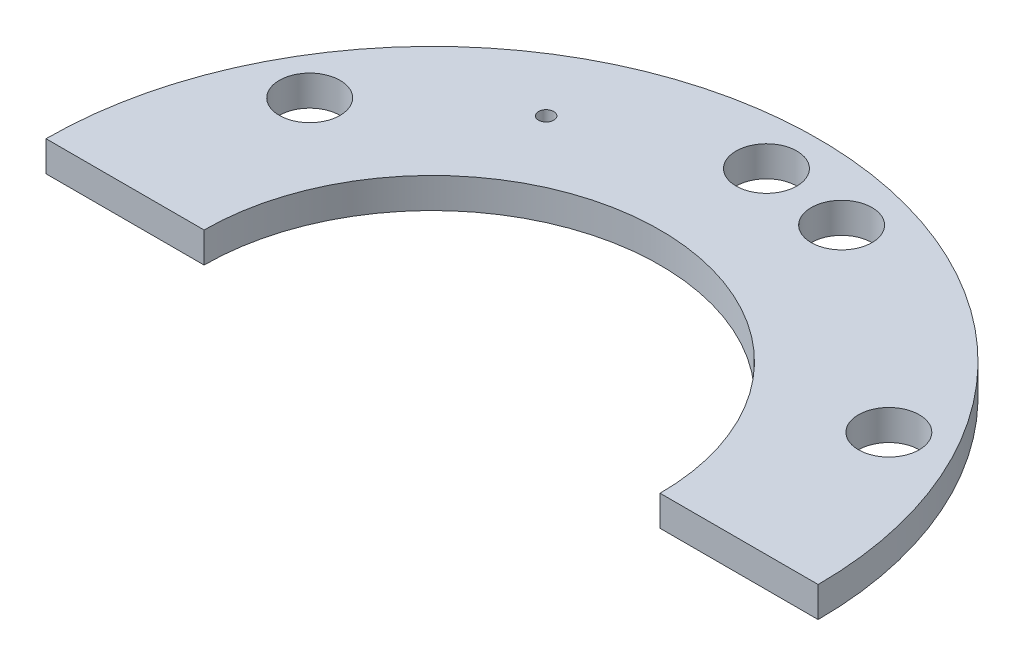
from build123d import *

# Parameters (mm, degrees)
SKETCH1_R               = 12.7
BOSS_EXTRUDE1_DEPTH     = 1
CUT_EXTRUDE1_DEPTH      = 18.98832955
CUT_EXTRUDE1_DEPTH_BACK = 18.98832955
SKETCH19_R              = 1
CUT_EXTRUDE2_DEPTH      = 18.98832955
CUT_EXTRUDE2_DEPTH_BACK = 18.98832955
SKETCH20_R              = 7.5
SKETCH21_W              = 65.874202484
SKETCH21_H              = 51.979273979
CUT_EXTRUDE3_DEPTH      = 18.98832955
CUT_EXTRUDE4_DEPTH      = 18.98832955
CUT_EXTRUDE4_DEPTH_BACK = 18.98832955
SKETCH22_R              = 0.25
CUT_EXTRUDE5_DEPTH      = 18.98832955
CUT_EXTRUDE5_DEPTH_BACK = 18.98832955
SKETCH23_R              = 1


with BuildPart() as part:
    # Sketch1 → Boss-Extrude1 (new body)
    with BuildSketch(Plane(origin=(0, 0, 0), x_dir=(1, 0, 0), z_dir=(0, 1, 0))):
        with Locations(Location((0, 0, 0), (0, 0, 270))):
            Circle(SKETCH1_R)
    extrude(amount=BOSS_EXTRUDE1_DEPTH)

    # Sketch19 → Cut-Extrude1 (cut, two sides: drawn at the far end of the back side and taken through both)
    with BuildSketch(Plane(origin=(0, 1, 0), x_dir=(1, 0, 0), z_dir=(0, 1, 0)).offset(-CUT_EXTRUDE1_DEPTH_BACK)):
        with Locations(Location((0, 11, 0), (0, 0, 270))):
            Circle(SKETCH19_R)
        with Locations(Location((9.526279442, 5.5, 0), (0, 0, 270))):
            Circle(SKETCH19_R)
        with Locations(Location((9.526279442, -5.5, 0), (0, 0, 270))):
            Circle(SKETCH19_R)
        with Locations(Location((0, -11, 0), (0, 0, 270))):
            Circle(SKETCH19_R)
        with Locations(Location((-9.526279442, -5.5, 0), (0, 0, 270))):
            Circle(SKETCH19_R)
        with Locations(Location((-9.526279442, 5.5, 0), (0, 0, 270))):
            Circle(SKETCH19_R)
    extrude(amount=CUT_EXTRUDE1_DEPTH + CUT_EXTRUDE1_DEPTH_BACK, mode=Mode.SUBTRACT)

    # Sketch20 → Cut-Extrude2 (cut, two sides: drawn at the far end of the back side and taken through both)
    with BuildSketch(Plane(origin=(0, 1, 0), x_dir=(1, 0, 0), z_dir=(0, 1, 0)).offset(-CUT_EXTRUDE2_DEPTH_BACK)):
        with Locations(Location((0, 0, 0), (0, 0, 270))):
            Circle(SKETCH20_R)
    extrude(amount=CUT_EXTRUDE2_DEPTH + CUT_EXTRUDE2_DEPTH_BACK, mode=Mode.SUBTRACT)

    # Sketch21 → Cut-Extrude3 (cut, through all)
    with BuildSketch(Plane.XY):
        with Locations((-3.816154381, 6.321647006)):
            Rectangle(SKETCH21_W, SKETCH21_H)
    extrude(amount=CUT_EXTRUDE3_DEPTH, mode=Mode.SUBTRACT)

    # Sketch22 → Cut-Extrude4 (cut, two sides: drawn at the far end of the back side and taken through both)
    with BuildSketch(Plane(origin=(0, 1, 0), x_dir=(1, 0, 0), z_dir=(0, 1, 0)).offset(-CUT_EXTRUDE4_DEPTH_BACK)):
        with Locations(Location((-5.125, 8.876760389, 0), (0, 0, 270))):
            Circle(SKETCH22_R)
    extrude(amount=CUT_EXTRUDE4_DEPTH + CUT_EXTRUDE4_DEPTH_BACK, mode=Mode.SUBTRACT)

    # Sketch23 → Cut-Extrude5 (cut, two sides: drawn at the far end of the back side and taken through both)
    with BuildSketch(Plane(origin=(0, 1, 0), x_dir=(1, 0, 0), z_dir=(0, 1, 0)).offset(-CUT_EXTRUDE5_DEPTH_BACK)):
        with Locations(Location((2.847009496, 10.625184089, 0), (0, 0, 270))):
            Circle(SKETCH23_R)
    extrude(amount=CUT_EXTRUDE5_DEPTH + CUT_EXTRUDE5_DEPTH_BACK, mode=Mode.SUBTRACT)


solid = part.part
